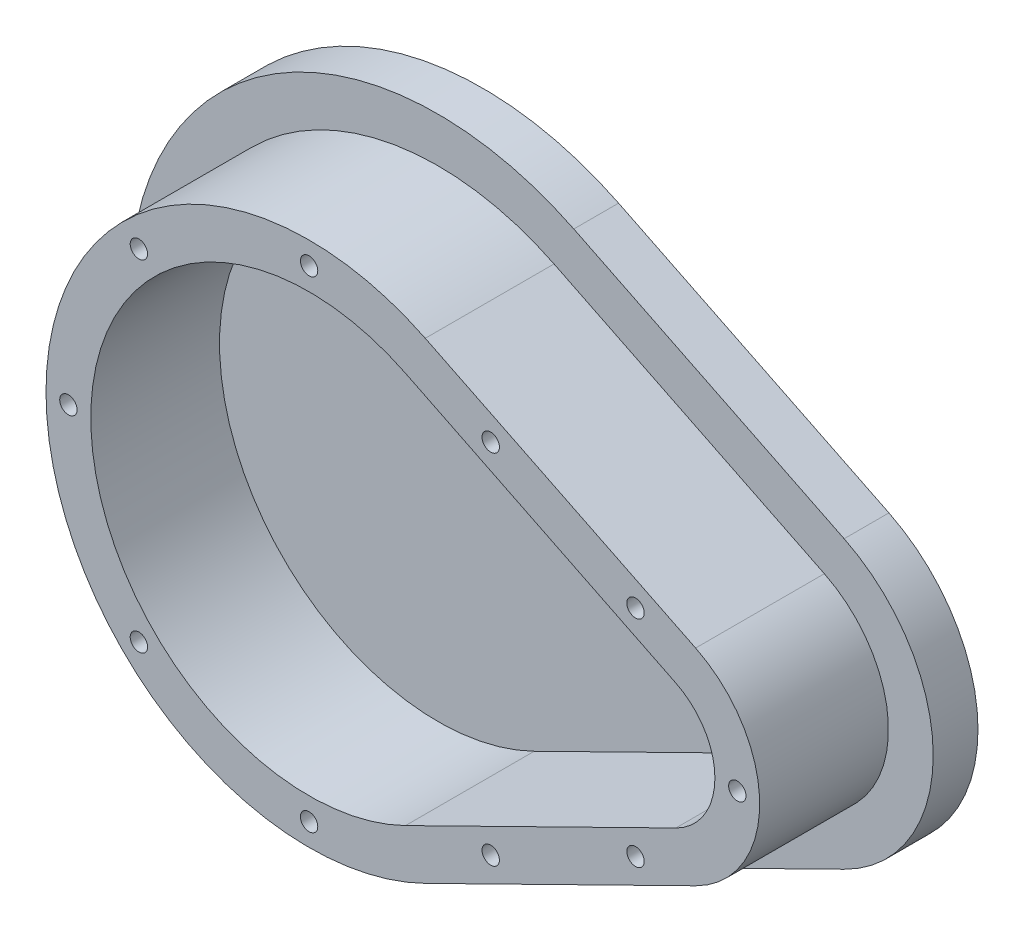
from build123d import *

# Parameters (mm, degrees)
BOSS_EXTRUDE2_DEPTH = 8
BOSS_EXTRUDE3_DEPTH = 23
SKETCH6_R           = 1.55
CUT_EXTRUDE1_DEPTH  = 31


with BuildPart() as part:
    # Sketch1 → Boss-Extrude2 (new body)
    with BuildSketch(Plane.XY):
        with BuildLine():
            Line((72.5875, 25.569607814), (24.291666667, 49.344857184))
            ThreePointArc((24.291666667, 49.344857184), (-55, 0), (24.291666667, -49.344857184))
            Line((24.291666667, -49.344857184), (72.5875, -25.569607814))
            ThreePointArc((72.5875, -25.569607814), (88.5, 0), (72.5875, 25.569607814))
        make_face()
    extrude(amount=BOSS_EXTRUDE2_DEPTH)

    # Sketch5 → Boss-Extrude3 (add)
    with BuildSketch(Plane.XY.offset(8)):
        with BuildLine():
            Line((20.758333333, 42.167423412), (69.054166667, 18.392174041))
            ThreePointArc((69.054166667, 18.392174041), (80.5, 0), (69.054166667, -18.392174041))
            Line((69.054166667, -18.392174041), (20.758333333, -42.167423412))
            ThreePointArc((20.758333333, -42.167423412), (-47, 0), (20.758333333, 42.167423412))
        make_face()
        with BuildLine():
            Line((65.520833333, 11.214740269), (17.225, 34.98998964))
            ThreePointArc((17.225, 34.98998964), (-39, 0), (17.225, -34.98998964))
            Line((17.225, -34.98998964), (65.520833333, -11.214740269))
            ThreePointArc((65.520833333, -11.214740269), (72.5, 0), (65.520833333, 11.214740269))
        make_face(mode=Mode.SUBTRACT)
    extrude(amount=BOSS_EXTRUDE3_DEPTH)

    # Sketch6 → Cut-Extrude1 (cut)
    with BuildSketch(Plane.XY.offset(31)):
        with Locations((0, 43)):
            Circle(SKETCH6_R)
        with Locations((-30.405591591, 30.405591591)):
            Circle(SKETCH6_R)
        with Locations((-43, 0)):
            Circle(SKETCH6_R)
        with Locations((-30.405591591, -30.405591591)):
            Circle(SKETCH6_R)
        with Locations((0, -43)):
            Circle(SKETCH6_R)
        with Locations((76.5, 0)):
            Circle(SKETCH6_R)
        with Locations((58.315707785, 19.220123822)):
            Circle(SKETCH6_R)
        with Locations((32.44935499, 31.953706526)):
            Circle(SKETCH6_R)
        with Locations((58.315707785, -19.220123822)):
            Circle(SKETCH6_R)
        with Locations((32.44935499, -31.953706526)):
            Circle(SKETCH6_R)
    extrude(amount=-CUT_EXTRUDE1_DEPTH, mode=Mode.SUBTRACT)


solid = part.part
